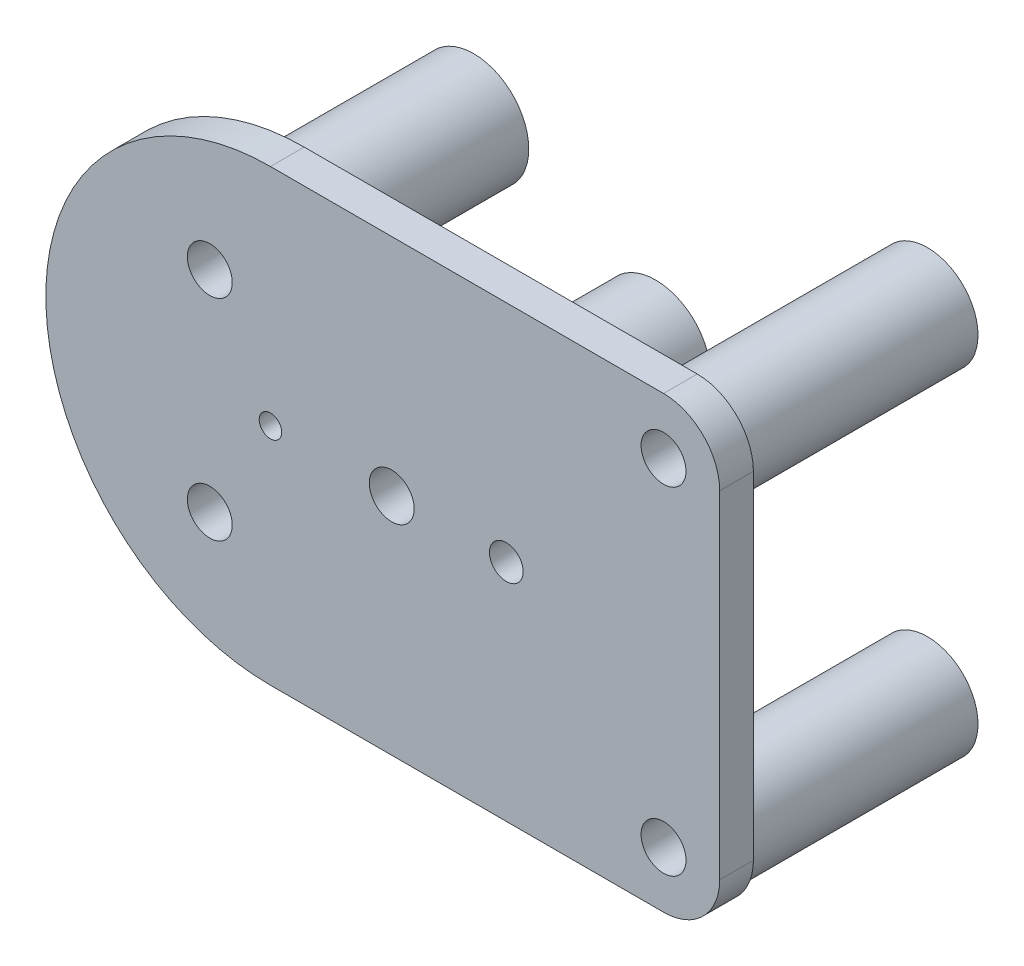
from build123d import *
from build123d.topology import SkipClean

# Parameters (mm, degrees)
SKIZZE1_R                       = 1.5
SKIZZE1_R_2                     = 1
SKIZZE1_R_3                     = 2
AUFSATZ_LINEAR_AUSTRAGEN1_DEPTH = 3
SKIZZE2_R                       = 4.9
AUFSATZ_LINEAR_AUSTRAGEN2_DEPTH = 20.5
SKIZZE3_R                       = 2
SCHNITT_LINEAR_AUSTRAGEN1_DEPTH = 51.519798099
VERRUNDUNG1_R                   = 5
AUFSATZ_LINEAR_START            = 20.5
SKIZZE4_R                       = 4.5
SKIZZE4_R_2                     = 2
AUFSATZ_LINEAR_AUSTRAGEN3_DEPTH = 20.5


with BuildPart() as part:
    # Skizze1 → Aufsatz-Linear austragen1 (new body)
    with BuildSketch(Plane.XY):
        with BuildLine():
            ThreePointArc((0, 20), (-20, 0), (0, -20))
            Line((0, -20), (40, -20))
            Line((40, -20), (40, 20))
            Line((40, 20), (0, 20))
        make_face()
        with Locations((21, 0)):
            Circle(SKIZZE1_R, mode=Mode.SUBTRACT)
        Circle(SKIZZE1_R_2, mode=Mode.SUBTRACT)
        with Locations((35, 15)):
            Circle(SKIZZE1_R_3, mode=Mode.SUBTRACT)
        with Locations((35, -15)):
            Circle(SKIZZE1_R_3, mode=Mode.SUBTRACT)
    extrude(amount=AUFSATZ_LINEAR_AUSTRAGEN1_DEPTH)

    # Skizze2 → Aufsatz-Linear austragen2 (add)
    with BuildSketch(Plane(origin=(0, 0, 0), x_dir=(-1, 0, 0), z_dir=(0, 0, -1))):
        with Locations(Location((-10.8, 0, 0), (0, 0, 180))):
            Circle(SKIZZE2_R)
        with Locations(Location((5.4, 9.353074361, 0), (0, 0, 180))):
            Circle(SKIZZE2_R)
        with Locations(Location((5.4, -9.353074361, 0), (0, 0, 180))):
            Circle(SKIZZE2_R)
    extrude(amount=AUFSATZ_LINEAR_AUSTRAGEN2_DEPTH)

    # Skizze3 → Schnitt-Linear austragen1 (cut, through all)
    with BuildSketch(Plane(origin=(0, 0, -20.5), x_dir=(-1, 0, 0), z_dir=(0, 0, -1))):
        with Locations((-10.8, 0)):
            Circle(SKIZZE3_R)
        with Locations((5.4, 9.353074361)):
            Circle(SKIZZE3_R)
        with Locations((5.4, -9.353074361)):
            Circle(SKIZZE3_R)
    extrude(amount=-SCHNITT_LINEAR_AUSTRAGEN1_DEPTH, mode=Mode.SUBTRACT)

    # Verrundung1
    verrundung1_edges = [part.edges().sort_by_distance(p)[0] for p in [
        (40, 20, 1.5),
        (40, -20, 1.5),
    ]]
    fillet(verrundung1_edges, radius=VERRUNDUNG1_R)

    # Skizze4 → Aufsatz-Linear austragen3 (add)
    # profile 1 of 2: a face of its own
    with SkipClean():  # the faces are left unmerged after this step: merging them gives an invalid solid
        with BuildSketch(Plane(origin=(0, 0, 0), x_dir=(-1, 0, 0), z_dir=(0, 0, -1)).offset(AUFSATZ_LINEAR_START)):
            with Locations(Location((-35, 15, 0), (0, 0, 180))):
                Circle(SKIZZE4_R)
            with Locations((-35, 15)):
                Circle(SKIZZE4_R_2, mode=Mode.SUBTRACT)
        # profile 2 of 2: a face of its own
        with BuildSketch(Plane(origin=(0, 0, 0), x_dir=(-1, 0, 0), z_dir=(0, 0, -1)).offset(AUFSATZ_LINEAR_START)):
            with Locations(Location((-35, -15, 0), (0, 0, 180))):
                Circle(SKIZZE4_R)
            with Locations((-35, -15)):
                Circle(SKIZZE4_R_2, mode=Mode.SUBTRACT)
        extrude(amount=-AUFSATZ_LINEAR_AUSTRAGEN3_DEPTH)


solid = part.part
